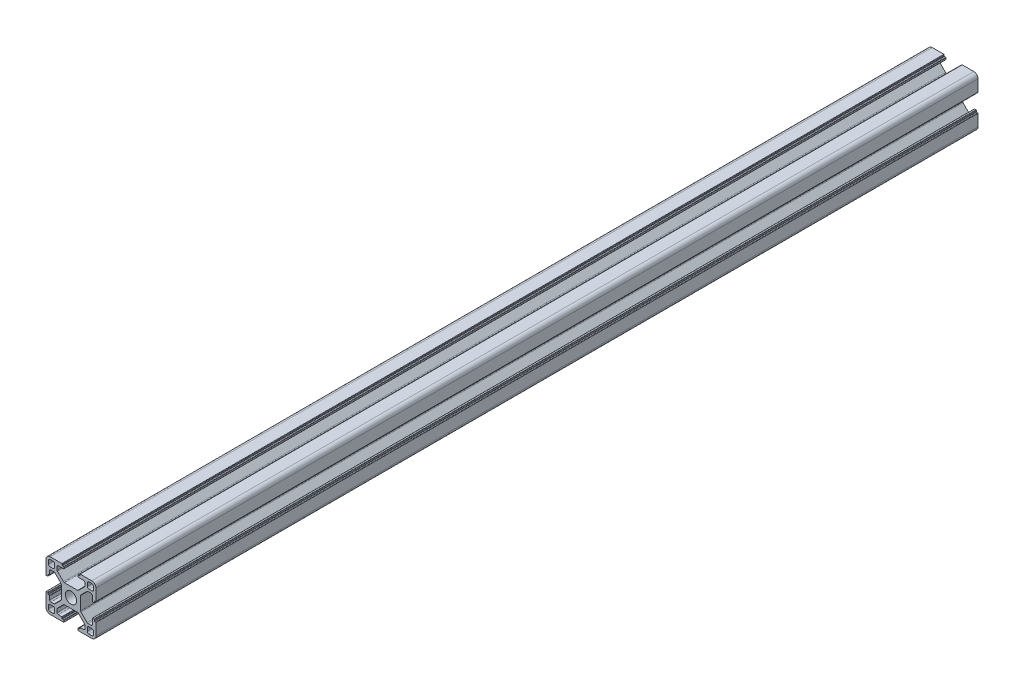
from build123d import *

# Parameters (mm, degrees)
SKETCH1_R           = 3.4
BOSS_EXTRUDE1_DEPTH = 530


with BuildPart() as part:
    # Sketch1 → Boss-Extrude1 (new body)
    with BuildSketch(Plane.XY):
        with BuildLine():
            Line((0, 2.5), (0, 10.6))
            ThreePointArc((0, 10.6), (0.058578644, 10.741421356), (0.2, 10.8))
            Line((0.2, 10.8), (1, 10.8))
            ThreePointArc((1, 10.8), (1.141421356, 10.741421356), (1.2, 10.6))
            Line((1.2, 10.6), (1.2, 9.9))
            ThreePointArc((1.2, 9.9), (1.258578644, 9.758578644), (1.4, 9.7))
            Line((1.4, 9.7), (2, 9.7))
            ThreePointArc((2, 9.7), (2.141421356, 9.641421356), (2.2, 9.5))
            Line((2.2, 9.5), (2.2, 7.4))
            ThreePointArc((2.2, 7.4), (2.419669914, 6.869669914), (2.95, 6.65))
            Line((2.95, 6.65), (4.78370491, 6.65))
            ThreePointArc((4.78370491, 6.65), (5.070717484, 6.707090351), (5.314034995, 6.869669914))
            Line((5.314034995, 6.869669914), (8.980330086, 10.535965005))
            ThreePointArc((8.980330086, 10.535965005), (9.142909649, 10.779282516), (9.2, 11.06629509))
            Line((9.2, 11.06629509), (9.2, 18.93370491))
            ThreePointArc((9.2, 18.93370491), (9.142909649, 19.220717484), (8.980330086, 19.464034995))
            Line((8.980330086, 19.464034995), (5.314034995, 23.130330086))
            ThreePointArc((5.314034995, 23.130330086), (5.070717484, 23.292909649), (4.78370491, 23.35))
            Line((4.78370491, 23.35), (2.95, 23.35))
            ThreePointArc((2.95, 23.35), (2.419669914, 23.130330086), (2.2, 22.6))
            Line((2.2, 22.6), (2.2, 20.5))
            ThreePointArc((2.2, 20.5), (2.141421356, 20.358578644), (2, 20.3))
            Line((2, 20.3), (1.4, 20.3))
            ThreePointArc((1.4, 20.3), (1.258578644, 20.241421356), (1.2, 20.1))
            Line((1.2, 20.1), (1.2, 19.4))
            ThreePointArc((1.2, 19.4), (1.141421356, 19.258578644), (1, 19.2))
            Line((1, 19.2), (0.2, 19.2))
            ThreePointArc((0.2, 19.2), (0.058578644, 19.258578644), (0, 19.4))
            Line((0, 19.4), (0, 27.5))
            ThreePointArc((0, 27.5), (0.732233047, 29.267766953), (2.5, 30))
            Line((2.5, 30), (9.5, 30))
            ThreePointArc((9.5, 30), (9.641421356, 29.941421356), (9.7, 29.8))
            Line((9.7, 29.8), (9.7, 29.2))
            ThreePointArc((9.7, 29.2), (9.758578644, 29.058578644), (9.9, 29))
            Line((9.9, 29), (10.6, 29))
            ThreePointArc((10.6, 29), (10.741421356, 28.941421356), (10.8, 28.8))
            Line((10.8, 28.8), (10.8, 28))
            ThreePointArc((10.8, 28), (10.741421356, 27.858578644), (10.6, 27.8))
            Line((10.6, 27.8), (7.4, 27.8))
            ThreePointArc((7.4, 27.8), (6.869669914, 27.580330086), (6.65, 27.05))
            Line((6.65, 27.05), (6.65, 25.21629509))
            ThreePointArc((6.65, 25.21629509), (6.707090351, 24.929282516), (6.869669914, 24.685965005))
            Line((6.869669914, 24.685965005), (10.535965005, 21.019669914))
            ThreePointArc((10.535965005, 21.019669914), (10.779282516, 20.857090351), (11.06629509, 20.8))
            Line((11.06629509, 20.8), (18.93370491, 20.8))
            ThreePointArc((18.93370491, 20.8), (19.220717484, 20.857090351), (19.464034995, 21.019669914))
            Line((19.464034995, 21.019669914), (23.130330086, 24.685965005))
            ThreePointArc((23.130330086, 24.685965005), (23.292909649, 24.929282516), (23.35, 25.21629509))
            Line((23.35, 25.21629509), (23.35, 27.05))
            ThreePointArc((23.35, 27.05), (23.130330086, 27.580330086), (22.6, 27.8))
            Line((22.6, 27.8), (19.4, 27.8))
            ThreePointArc((19.4, 27.8), (19.258578644, 27.858578644), (19.2, 28))
            Line((19.2, 28), (19.2, 28.8))
            ThreePointArc((19.2, 28.8), (19.258578644, 28.941421356), (19.4, 29))
            Line((19.4, 29), (20.1, 29))
            ThreePointArc((20.1, 29), (20.241421356, 29.058578644), (20.3, 29.2))
            Line((20.3, 29.2), (20.3, 29.8))
            ThreePointArc((20.3, 29.8), (20.358578644, 29.941421356), (20.5, 30))
            Line((20.5, 30), (27.5, 30))
            ThreePointArc((27.5, 30), (29.267766953, 29.267766953), (30, 27.5))
            Line((30, 27.5), (30, 20.5))
            ThreePointArc((30, 20.5), (29.941421356, 20.358578644), (29.8, 20.3))
            Line((29.8, 20.3), (29.2, 20.3))
            ThreePointArc((29.2, 20.3), (29.058578644, 20.241421356), (29, 20.1))
            Line((29, 20.1), (29, 19.4))
            ThreePointArc((29, 19.4), (28.941421356, 19.258578644), (28.8, 19.2))
            Line((28.8, 19.2), (28, 19.2))
            ThreePointArc((28, 19.2), (27.858578644, 19.258578644), (27.8, 19.4))
            Line((27.8, 19.4), (27.8, 22.6))
            ThreePointArc((27.8, 22.6), (27.580330086, 23.130330086), (27.05, 23.35))
            Line((27.05, 23.35), (25.21629509, 23.35))
            ThreePointArc((25.21629509, 23.35), (24.929282516, 23.292909649), (24.685965005, 23.130330086))
            Line((24.685965005, 23.130330086), (21.019669914, 19.464034995))
            ThreePointArc((21.019669914, 19.464034995), (20.857090351, 19.220717484), (20.8, 18.93370491))
            Line((20.8, 18.93370491), (20.8, 11.06629509))
            ThreePointArc((20.8, 11.06629509), (20.857090351, 10.779282516), (21.019669914, 10.535965005))
            Line((21.019669914, 10.535965005), (24.685965005, 6.869669914))
            ThreePointArc((24.685965005, 6.869669914), (24.929282516, 6.707090351), (25.21629509, 6.65))
            Line((25.21629509, 6.65), (27.05, 6.65))
            ThreePointArc((27.05, 6.65), (27.580330086, 6.869669914), (27.8, 7.4))
            Line((27.8, 7.4), (27.8, 10.6))
            ThreePointArc((27.8, 10.6), (27.858578644, 10.741421356), (28, 10.8))
            Line((28, 10.8), (28.8, 10.8))
            ThreePointArc((28.8, 10.8), (28.941421356, 10.741421356), (29, 10.6))
            Line((29, 10.6), (29, 9.9))
            ThreePointArc((29, 9.9), (29.058578644, 9.758578644), (29.2, 9.7))
            Line((29.2, 9.7), (29.8, 9.7))
            ThreePointArc((29.8, 9.7), (29.941421356, 9.641421356), (30, 9.5))
            Line((30, 9.5), (30, 2.5))
            ThreePointArc((30, 2.5), (29.267766953, 0.732233047), (27.5, 0))
            Line((27.5, 0), (19.4, 0))
            ThreePointArc((19.4, 0), (19.258578644, 0.058578644), (19.2, 0.2))
            Line((19.2, 0.2), (19.2, 1.132430858))
            ThreePointArc((19.2, 1.132430858), (19.258578644, 1.273852214), (19.4, 1.332430858))
            Line((19.4, 1.332430858), (20.1, 1.332430858))
            ThreePointArc((20.1, 1.332430858), (20.241421356, 1.391009502), (20.3, 1.532430858))
            Line((20.3, 1.532430858), (20.3, 2))
            ThreePointArc((20.3, 2), (20.358578644, 2.141421356), (20.5, 2.2))
            Line((20.5, 2.2), (22.6, 2.2))
            ThreePointArc((22.6, 2.2), (23.130330086, 2.419669914), (23.35, 2.95))
            Line((23.35, 2.95), (23.35, 4.916135768))
            ThreePointArc((23.35, 4.916135768), (23.292909649, 5.203148342), (23.130330086, 5.446465854))
            Line((23.130330086, 5.446465854), (19.464034995, 9.112760944))
            ThreePointArc((19.464034995, 9.112760944), (19.220717484, 9.275340508), (18.93370491, 9.332430858))
            Line((18.93370491, 9.332430858), (11.06629509, 9.332430858))
            ThreePointArc((11.06629509, 9.332430858), (10.779282516, 9.275340508), (10.535965005, 9.112760944))
            Line((10.535965005, 9.112760944), (6.869669914, 5.446465854))
            ThreePointArc((6.869669914, 5.446465854), (6.707090351, 5.203148342), (6.65, 4.916135768))
            Line((6.65, 4.916135768), (6.65, 3.082430858))
            ThreePointArc((6.65, 3.082430858), (6.869669914, 2.552100772), (7.4, 2.332430858))
            Line((7.4, 2.332430858), (9.5, 2.332430858))
            ThreePointArc((9.5, 2.332430858), (9.641421356, 2.273852214), (9.7, 2.132430858))
            Line((9.7, 2.132430858), (9.7, 1.532430858))
            ThreePointArc((9.7, 1.532430858), (9.758578644, 1.391009502), (9.9, 1.332430858))
            Line((9.9, 1.332430858), (10.6, 1.332430858))
            ThreePointArc((10.6, 1.332430858), (10.741421356, 1.273852214), (10.8, 1.132430858))
            Line((10.8, 1.132430858), (10.8, 0.2))
            ThreePointArc((10.8, 0.2), (10.741421356, 0.058578644), (10.6, 0))
            Line((10.6, 0), (2.5, 0))
            ThreePointArc((2.5, 0), (0.732233047, 0.732233047), (0, 2.5))
        make_face()
        with Locations((15, 15)):
            Circle(SKETCH1_R, mode=Mode.SUBTRACT)
        with BuildLine():
            Line((27.55, 1.45), (25.8, 1.45))
            ThreePointArc((25.8, 1.45), (25.092893219, 1.742893219), (24.8, 2.45))
            Line((24.8, 2.45), (24.8, 4.2))
            ThreePointArc((24.8, 4.2), (25.092893219, 4.907106781), (25.8, 5.2))
            Line((25.8, 5.2), (27.55, 5.2))
            ThreePointArc((27.55, 5.2), (28.257106781, 4.907106781), (28.55, 4.2))
            Line((28.55, 4.2), (28.55, 2.45))
            ThreePointArc((28.55, 2.45), (28.257106781, 1.742893219), (27.55, 1.45))
        make_face(mode=Mode.SUBTRACT)
        with BuildLine():
            Line((24.8, 25.8), (24.8, 27.55))
            ThreePointArc((24.8, 27.55), (25.092893219, 28.257106781), (25.8, 28.55))
            Line((25.8, 28.55), (27.55, 28.55))
            ThreePointArc((27.55, 28.55), (28.257106781, 28.257106781), (28.55, 27.55))
            Line((28.55, 27.55), (28.55, 25.8))
            ThreePointArc((28.55, 25.8), (28.257106781, 25.092893219), (27.55, 24.8))
            Line((27.55, 24.8), (25.8, 24.8))
            ThreePointArc((25.8, 24.8), (25.092893219, 25.092893219), (24.8, 25.8))
        make_face(mode=Mode.SUBTRACT)
        with BuildLine():
            Line((2.45, 28.55), (4.2, 28.55))
            ThreePointArc((4.2, 28.55), (4.907106781, 28.257106781), (5.2, 27.55))
            Line((5.2, 27.55), (5.2, 25.8))
            ThreePointArc((5.2, 25.8), (4.907106781, 25.092893219), (4.2, 24.8))
            Line((4.2, 24.8), (2.45, 24.8))
            ThreePointArc((2.45, 24.8), (1.742893219, 25.092893219), (1.45, 25.8))
            Line((1.45, 25.8), (1.45, 27.55))
            ThreePointArc((1.45, 27.55), (1.742893219, 28.257106781), (2.45, 28.55))
        make_face(mode=Mode.SUBTRACT)
        with BuildLine():
            Line((1.45, 2.45), (1.45, 4.2))
            ThreePointArc((1.45, 4.2), (1.742893219, 4.907106781), (2.45, 5.2))
            Line((2.45, 5.2), (4.2, 5.2))
            ThreePointArc((4.2, 5.2), (4.907106781, 4.907106781), (5.2, 4.2))
            Line((5.2, 4.2), (5.2, 2.45))
            ThreePointArc((5.2, 2.45), (4.907106781, 1.742893219), (4.2, 1.45))
            Line((4.2, 1.45), (2.45, 1.45))
            ThreePointArc((2.45, 1.45), (1.742893219, 1.742893219), (1.45, 2.45))
        make_face(mode=Mode.SUBTRACT)
    extrude(amount=BOSS_EXTRUDE1_DEPTH)


solid = part.part
